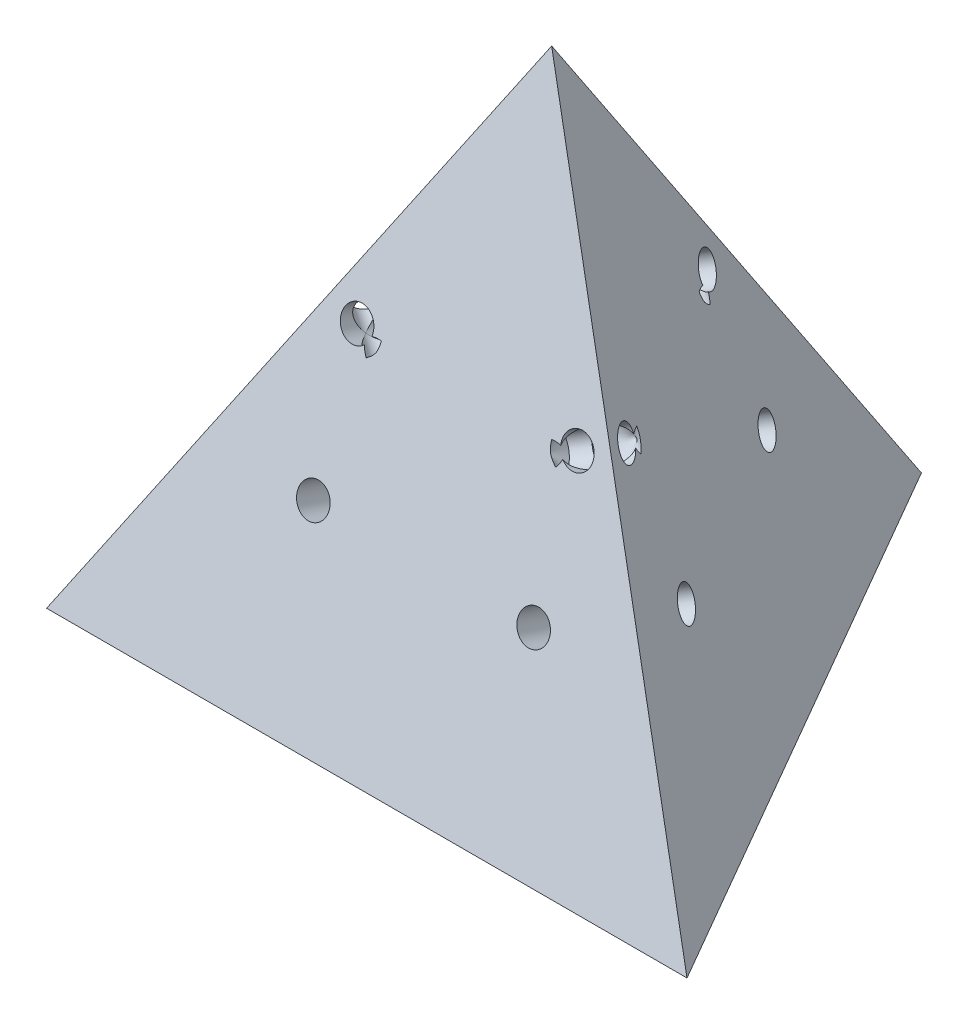
from build123d import *

# Parameters (mm, degrees)
M14X1_5_1_AT_2_COUNT     = 2
M14X1_5_1_AT_2_PITCH     = 86
M14X1_5_1_AT_3_COUNT     = 2
M14X1_5_1_AT_3_PITCH     = 101.548018198
M14X1_5_1_AT_4_COUNT     = 2
M14X1_5_1_AT_4_PITCH     = 54
PATTERN_CIRCULAR_1_COUNT = 3


with BuildPart() as part:
    # 草圖1 → 疊層拉伸1 section 0
    with BuildSketch(Plane(origin=(0, 0, 0), x_dir=(1, 0, 0), z_dir=(0, 1, 0)), mode=Mode.PRIVATE) as loft_1_s0:
        with BuildLine():
            Line((0, 0), (-125, 0))
            Line((-125, 0), (0, 216.506350946))
            Line((0, 216.506350946), (125, 0))
            Line((125, 0), (0, 0))
        make_face()
    loft([loft_1_s0.sketch, Vertex(0, 216.5, -72.168783649)])

    # 草圖3 → M14x1.5 螺紋孔1 (revolve, cut)
    with BuildSketch(Plane(origin=(-43, 117.636383872, -39.21327823), x_dir=(0, -0.9486805150951512, 0.3162361147604725), z_dir=(1, 0, 0))):
        Polygon((0, 0), (0, 23.755378869), (6.25, 20), (6.25, 0), align=None)
    m14x1_5_1 = revolve(axis=Axis((-43, 119.644483201, -33.189156959), (0, -0.31623611476047253, -0.9486805150951512)), mode=Mode.SUBTRACT)

    # M14x1.5 螺紋孔1 at 2: M14x1.5 螺紋孔1 ×2
    with Locations(*[(i * M14X1_5_1_AT_2_PITCH, 0, 0) for i in range(1, M14X1_5_1_AT_2_COUNT)]):
        add(m14x1_5_1, mode=Mode.SUBTRACT)

    # M14x1.5 螺紋孔1 at 3: M14x1.5 螺紋孔1 ×2
    with Locations(*[Vector(0.8468899888530682, -0.5044780658851046, 0.1681642881865052) * (i * M14X1_5_1_AT_3_PITCH) for i in range(1, M14X1_5_1_AT_3_COUNT)]):
        add(m14x1_5_1, mode=Mode.SUBTRACT)

    # M14x1.5 螺紋孔1 at 4: M14x1.5 螺紋孔1 ×2
    with Locations(*[Vector(0, -0.9486805150951512, 0.3162361147604726) * (i * M14X1_5_1_AT_4_PITCH) for i in range(1, M14X1_5_1_AT_4_COUNT)]):
        add(m14x1_5_1, mode=Mode.SUBTRACT)

    # 環狀複製排列1: M14x1.5 螺紋孔1 ×3 about axis
    pattern_circular_1_axis = Axis((0, 216.5, -72.168783649), (0, -1, 0))
    for i in range(1, PATTERN_CIRCULAR_1_COUNT):
        add(m14x1_5_1.rotate(pattern_circular_1_axis, i * 360 / PATTERN_CIRCULAR_1_COUNT), mode=Mode.SUBTRACT)

    # 環狀複製排列1 copy 1 sketch → 環狀複製排列1 copy 1 (revolve, cut)
    with BuildSketch(Plane(origin=(-50.040304887, 117.636383872, -51.407443995), x_dir=(-0.27386850897666026, -0.9486805150951512, -0.15811805738023615), z_dir=(-0.4999999999999998, 0, 0.8660254037844387))):
        Polygon((0, 0), (0, 23.755378869), (6.25, 20), (6.25, 0), align=None)
    revolve(axis=Axis((-55.257346943, 119.644483201, -54.419504631), (0.8215814261477076, -0.31623611476047253, 0.47434025754757536)), mode=Mode.SUBTRACT)

    # 環狀複製排列1 copy 2 sketch → 環狀複製排列1 copy 2 (revolve, cut)
    with BuildSketch(Plane(origin=(7.040304887, 117.636383872, -125.885628721), x_dir=(0.27386850897666015, -0.9486805150951512, -0.15811805738023638), z_dir=(-0.5000000000000004, 0, -0.8660254037844384))):
        Polygon((0, 0), (0, 23.755378869), (6.25, 20), (6.25, 0), align=None)
    revolve(axis=Axis((12.257346943, 119.644483201, -128.897689356), (-0.8215814261477072, -0.31623611476047253, 0.474340257547576)), mode=Mode.SUBTRACT)

    # 環狀複製排列1 copy 3 sketch → 環狀複製排列1 copy 3 (revolve, cut)
    with BuildSketch(Plane(origin=(-64.829204372, 66.407636057, -59.945819094), x_dir=(-0.27386850897666026, -0.9486805150951512, -0.15811805738023615), z_dir=(-0.4999999999999998, 0, 0.8660254037844387))):
        Polygon((0, 0), (0, 23.755378869), (6.25, 20), (6.25, 0), align=None)
    revolve(axis=Axis((-70.046246428, 68.415735385, -62.957879729), (0.8215814261477076, -0.31623611476047253, 0.47434025754757536)), mode=Mode.SUBTRACT)

    # 環狀複製排列1 copy 4 sketch → 環狀複製排列1 copy 4 (revolve, cut)
    with BuildSketch(Plane(origin=(21.829204372, 66.407636057, -134.424003819), x_dir=(0.27386850897666015, -0.9486805150951512, -0.15811805738023638), z_dir=(-0.5000000000000004, 0, -0.8660254037844384))):
        Polygon((0, 0), (0, 23.755378869), (6.25, 20), (6.25, 0), align=None)
    revolve(axis=Axis((27.046246428, 68.415735385, -137.436064455), (-0.8215814261477072, -0.31623611476047253, 0.474340257547576)), mode=Mode.SUBTRACT)

    # 環狀複製排列1 copy 5 sketch → 環狀複製排列1 copy 5 (revolve, cut)
    with BuildSketch(Plane(origin=(-21.829204372, 66.407636057, -134.424003819), x_dir=(-0.27386850897666026, -0.9486805150951512, -0.15811805738023615), z_dir=(-0.4999999999999998, 0, 0.8660254037844387))):
        Polygon((0, 0), (0, 23.755378869), (6.25, 20), (6.25, 0), align=None)
    revolve(axis=Axis((-27.046246428, 68.415735385, -137.436064455), (0.8215814261477076, -0.31623611476047253, 0.47434025754757536)), mode=Mode.SUBTRACT)

    # 環狀複製排列1 copy 6 sketch → 環狀複製排列1 copy 6 (revolve, cut)
    with BuildSketch(Plane(origin=(64.829204372, 66.407636057, -59.945819094), x_dir=(0.27386850897666015, -0.9486805150951512, -0.15811805738023638), z_dir=(-0.5000000000000004, 0, -0.8660254037844384))):
        Polygon((0, 0), (0, 23.755378869), (6.25, 20), (6.25, 0), align=None)
    revolve(axis=Axis((70.046246428, 68.415735385, -62.957879729), (-0.8215814261477072, -0.31623611476047253, 0.474340257547576)), mode=Mode.SUBTRACT)


solid = part.part
